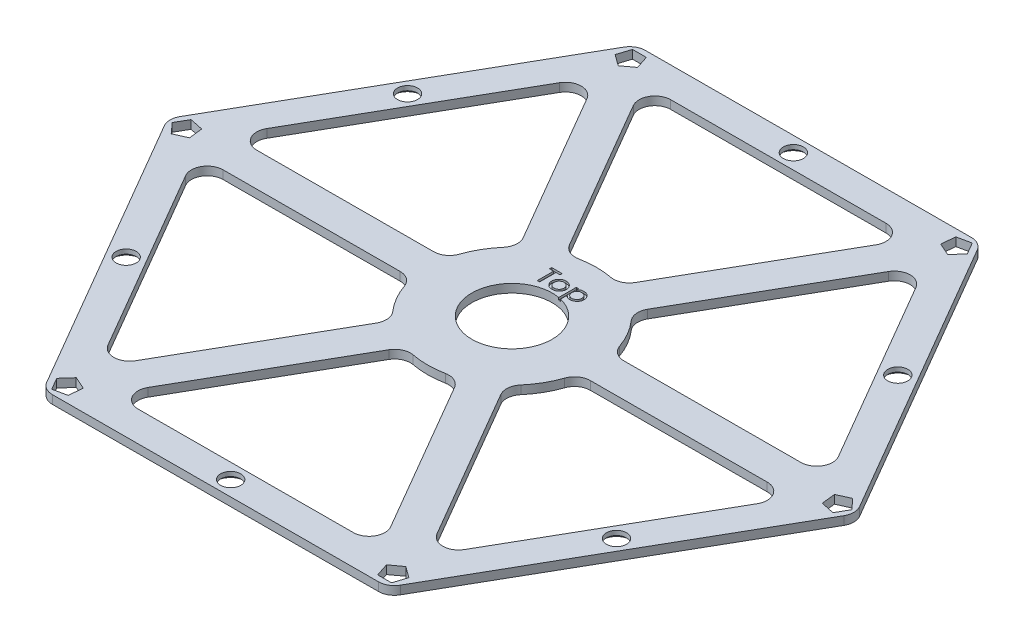
from build123d import *
from OCP.BRepFilletAPI import BRepFilletAPI_MakeChamfer

# Parameters (mm, degrees)
SKETCH1_R           = 1.9
BOSS_EXTRUDE1_DEPTH = 1.6
FILLET1_R           = 3
FILLET2_R           = 3
SKETCH3_R           = 7.6
CUT_EXTRUDE1_DEPTH  = 10
CHAMFER1_SIZE       = 0.75
CHAMFER1_SIZE2      = 0.832959386
CUT_EXTRUDE2_DEPTH  = 0.4
SCALE1_SCALE        = 1.15


with BuildPart() as part:
    # Sketch1 → Boss-Extrude1 (new body)
    with BuildSketch(Plane(origin=(0, 0, 0), x_dir=(1, 0, 0), z_dir=(0, 1, 0))):
        Polygon((-32.670459977, 56.192891409), (-64.999701461, -0.197002589), (-32.329241484, -56.389893998), (32.670459977, -56.192891409), (64.999701461, 0.197002589), (32.329241484, 56.389893998), align=None)
        with Locations(Location((-46.355761236, 26.576510309, 0), (0, 0, 270))):
            Circle(SKETCH1_R, mode=Mode.SUBTRACT)
        with Locations(Location((-0.161947547, 53.433521997, 0), (0, 0, 270))):
            Circle(SKETCH1_R, mode=Mode.SUBTRACT)
        with Locations(Location((46.19381369, 26.857011688, 0), (0, 0, 270))):
            Circle(SKETCH1_R, mode=Mode.SUBTRACT)
        with Locations(Location((46.355761236, -26.576510309, 0), (0, 0, 270))):
            Circle(SKETCH1_R, mode=Mode.SUBTRACT)
        with Locations(Location((0.161947547, -53.433521997, 0), (0, 0, 270))):
            Circle(SKETCH1_R, mode=Mode.SUBTRACT)
        with Locations(Location((-46.19381369, -26.857011688, 0), (0, 0, 270))):
            Circle(SKETCH1_R, mode=Mode.SUBTRACT)
        with BuildLine():
            Line((-31.193440085, 47.277250649), (-56.559443422, 3.032901767))
            Line((-56.559443422, 3.032901767), (-15.685493875, 3.156783473))
            ThreePointArc((-15.685493875, 3.156783473), (-13.880589292, 7.957967134), (-10.649180608, 11.941312842))
            Line((-10.649180608, 11.941312842), (-31.193440085, 47.277250649))
        make_face(mode=Mode.SUBTRACT)
        with BuildLine():
            Line((-56.540020126, -3.375686221), (-30.906291689, -47.465463944))
            Line((-30.906291689, -47.465463944), (-10.576601619, -12.00564443))
            ThreePointArc((-10.576601619, -12.00564443), (-13.832096347, -8.041959379), (-15.666070579, -3.251804515))
            Line((-15.666070579, -3.251804515), (-56.540020126, -3.375686221))
        make_face(mode=Mode.SUBTRACT)
        with BuildLine():
            Line((-25.346580041, -50.65293687), (25.653151733, -50.498365711))
            Line((25.653151733, -50.498365711), (5.108892256, -15.162427903))
            ThreePointArc((5.108892256, -15.162427903), (0.048492945, -15.999926513), (-5.016889971, -15.193117357))
            Line((-5.016889971, -15.193117357), (-25.346580041, -50.65293687))
        make_face(mode=Mode.SUBTRACT)
        with BuildLine():
            Line((31.193440085, -47.277250649), (56.559443422, -3.032901767))
            Line((56.559443422, -3.032901767), (15.685493875, -3.156783473))
            ThreePointArc((15.685493875, -3.156783473), (13.880589292, -7.957967134), (10.649180608, -11.941312842))
            Line((10.649180608, -11.941312842), (31.193440085, -47.277250649))
        make_face(mode=Mode.SUBTRACT)
        with BuildLine():
            Line((56.540020126, 3.375686221), (30.906291689, 47.465463944))
            Line((30.906291689, 47.465463944), (10.576601619, 12.00564443))
            ThreePointArc((10.576601619, 12.00564443), (13.832096347, 8.041959379), (15.666070579, 3.251804515))
            Line((15.666070579, 3.251804515), (56.540020126, 3.375686221))
        make_face(mode=Mode.SUBTRACT)
        with BuildLine():
            Line((25.346580041, 50.65293687), (-25.653151733, 50.498365711))
            Line((-25.653151733, 50.498365711), (-5.108892256, 15.162427903))
            ThreePointArc((-5.108892256, 15.162427903), (-0.048492945, 15.999926513), (5.016889971, 15.193117357))
            Line((5.016889971, 15.193117357), (25.346580041, 50.65293687))
        make_face(mode=Mode.SUBTRACT)
        Polygon((28.764451985, 52.408726504), (31.157091964, 51.352131998), (32.90133947, 53.301162184), (31.586703733, 55.562323589), (29.029966659, 55.010768007), align=None, mode=Mode.SUBTRACT)
        Polygon((-31.00506254, 51.115109397), (-28.893704867, 52.658899148), (-29.709490768, 55.143976891), (-32.325031855, 55.136049649), (-33.125739246, 52.646072601), align=None, mode=Mode.SUBTRACT)
        Polygon((59.769514525, 1.293617108), (60.050796831, -1.30676715), (62.610830237, -1.842814707), (63.911735588, 0.42627394), (62.155705905, 2.364695405), align=None, mode=Mode.SUBTRACT)
        Polygon((31.00506254, -51.115109397), (28.893704867, -52.658899148), (29.709490768, -55.143976891), (32.325031855, -55.136049649), (33.125739246, -52.646072601), align=None, mode=Mode.SUBTRACT)
        Polygon((-28.764451985, -52.408726504), (-31.157091964, -51.352131998), (-32.90133947, -53.301162184), (-31.586703733, -55.562323589), (-29.029966659, -55.010768007), align=None, mode=Mode.SUBTRACT)
        Polygon((-59.769514525, -1.293617108), (-60.050796831, 1.30676715), (-62.610830237, 1.842814707), (-63.911735588, -0.42627394), (-62.155705905, -2.364695405), align=None, mode=Mode.SUBTRACT)
    extrude(amount=BOSS_EXTRUDE1_DEPTH)

    # Fillet1
    fillet1_edges = [part.edges().sort_by_distance(p)[0] for p in [
        (32.329241484, 0.8, -56.389893998),
        (64.999701461, 0.8, -0.197002589),
        (32.670459977, 0.8, 56.192891409),
        (-32.329241484, 0.8, 56.389893998),
        (-64.999701461, 0.8, 0.197002589),
        (-32.670459977, 0.8, -56.192891409),
    ]]
    fillet(fillet1_edges, radius=FILLET1_R)

    # Fillet2
    fillet2_edges = [part.edges().sort_by_distance(p)[0] for p in [
        (-25.653151733, 0.8, -50.498365711),
        (-5.108892256, 0.8, -15.162427903),
        (5.016889971, 0.8, -15.193117357),
        (25.346580041, 0.8, -50.65293687),
        (30.906291689, 0.8, -47.465463944),
        (10.576601619, 0.8, -12.00564443),
        (15.666070579, 0.8, -3.251804515),
        (56.540020126, 0.8, -3.375686221),
        (56.559443422, 0.8, 3.032901767),
        (15.685493875, 0.8, 3.156783473),
        (10.649180608, 0.8, 11.941312842),
        (31.193440085, 0.8, 47.277250649),
        (25.653151733, 0.8, 50.498365711),
        (5.108892256, 0.8, 15.162427903),
        (-5.016889971, 0.8, 15.193117357),
        (-25.346580041, 0.8, 50.65293687),
        (-10.649180608, 0.8, -11.941312842),
        (-31.193440085, 0.8, -47.277250649),
        (-30.906291689, 0.8, 47.465463944),
        (-10.576601619, 0.8, 12.00564443),
        (-15.666070579, 0.8, 3.251804515),
        (-56.540020126, 0.8, 3.375686221),
        (-56.559443422, 0.8, -3.032901767),
        (-15.685493875, 0.8, -3.156783473),
    ]]
    fillet(fillet2_edges, radius=FILLET2_R)

    # Sketch3 → Cut-Extrude1 (cut)
    with BuildSketch(Plane(origin=(0, 3.6, 0), x_dir=(1, 0, 0), z_dir=(0, 1, 0))):
        with Locations(Location((0, 0, 0), (0, 0, 270))):
            Circle(SKETCH3_R)
    extrude(amount=-CUT_EXTRUDE1_DEPTH, mode=Mode.SUBTRACT)

    # Chamfer1: one chamfer whose edges measure the first distance from different faces: ONE call of the kernel's chamfer builder (chamfer() names one face for all edges)
    chamfer1_edges_1 = [part.edges().sort_by_distance(p)[0] for p in [
        (-0.161947547, 0, -55.333521997),
    ]]
    chamfer1_side_1 = [part.faces().sort_by_distance(p)[0] for p in [
        (-0.161947547, 0.8, -55.333521997),
    ]]
    chamfer1_edges_2 = [part.edges().sort_by_distance(p)[0] for p in [
        (46.19381369, 0, -28.757011688),
    ]]
    chamfer1_side_2 = [part.faces().sort_by_distance(p)[0] for p in [
        (46.19381369, 0.8, -28.757011688),
    ]]
    chamfer1_edges_3 = [part.edges().sort_by_distance(p)[0] for p in [
        (46.355761236, 0, 24.676510309),
    ]]
    chamfer1_side_3 = [part.faces().sort_by_distance(p)[0] for p in [
        (46.355761236, 0.8, 24.676510309),
    ]]
    chamfer1_edges_4 = [part.edges().sort_by_distance(p)[0] for p in [
        (0.161947547, 0, 51.533521997),
    ]]
    chamfer1_side_4 = [part.faces().sort_by_distance(p)[0] for p in [
        (0.161947547, 0.8, 51.533521997),
    ]]
    chamfer1_edges_5 = [part.edges().sort_by_distance(p)[0] for p in [
        (-46.19381369, 0, 24.957011688),
    ]]
    chamfer1_side_5 = [part.faces().sort_by_distance(p)[0] for p in [
        (-46.19381369, 0.8, 24.957011688),
    ]]
    chamfer1_edges_6 = [part.edges().sort_by_distance(p)[0] for p in [
        (-46.355761236, 0, -28.476510309),
    ]]
    chamfer1_side_6 = [part.faces().sort_by_distance(p)[0] for p in [
        (-46.355761236, 0.8, -28.476510309),
    ]]
    chamfer1 = BRepFilletAPI_MakeChamfer(part.part.solid().wrapped)
    for e in chamfer1_edges_1:
        chamfer1.Add(CHAMFER1_SIZE, CHAMFER1_SIZE2, e.wrapped, chamfer1_side_1[0].wrapped)  # the first distance lies on this face
    for e in chamfer1_edges_2:
        chamfer1.Add(CHAMFER1_SIZE, CHAMFER1_SIZE2, e.wrapped, chamfer1_side_2[0].wrapped)  # the first distance lies on this face
    for e in chamfer1_edges_3:
        chamfer1.Add(CHAMFER1_SIZE, CHAMFER1_SIZE2, e.wrapped, chamfer1_side_3[0].wrapped)  # the first distance lies on this face
    for e in chamfer1_edges_4:
        chamfer1.Add(CHAMFER1_SIZE, CHAMFER1_SIZE2, e.wrapped, chamfer1_side_4[0].wrapped)  # the first distance lies on this face
    for e in chamfer1_edges_5:
        chamfer1.Add(CHAMFER1_SIZE, CHAMFER1_SIZE2, e.wrapped, chamfer1_side_5[0].wrapped)  # the first distance lies on this face
    for e in chamfer1_edges_6:
        chamfer1.Add(CHAMFER1_SIZE, CHAMFER1_SIZE2, e.wrapped, chamfer1_side_6[0].wrapped)  # the first distance lies on this face
    add(Compound.cast(chamfer1.Shape()), mode=Mode.REPLACE)

    # Sketch4 → Cut-Extrude2 (cut)
    # profile 1 of 3: a face of its own
    with BuildSketch(Plane(origin=(0, 1.6, 0), x_dir=(1, 0, 0), z_dir=(0, 1, 0))):
        Polygon((-4.195512821, 11.318192168), (-4.195512821, 11.722038322), (-2.221153846, 11.722038322), (-2.221153846, 11.318192168), (-2.983974359, 11.318192168), (-2.983974359, 8.222038322), (-3.432692308, 8.222038322), (-3.432692308, 11.318192168), align=None)
    # profile 2 of 3: a face of its own
    with BuildSketch(Plane(origin=(0, 1.6, 0), x_dir=(1, 0, 0), z_dir=(0, 1, 0))):
        with BuildLine():
            add(Edge.make_bspline(
                [(-0.626802885, 10.86947422), (-0.574862942, 10.868051851), (-0.473174337, 10.865267121), (-0.324377097, 10.84567523), (-0.183079004, 10.811634981), (-0.048875089, 10.76504469), (0.077682331, 10.70400491), (0.196909356, 10.630157317), (0.308379715, 10.542065977), (0.37552529, 10.474519901), (0.409455128, 10.440387681)],
                knots=[0, 0, 0, 0, 1.078775739, 2.112039281, 3.110494877, 4.093081892, 5.057110616, 6.022958758, 7.000966324, 8, 8, 8, 8], degree=3))
            add(Edge.make_bspline(
                [(0.409455128, 10.440387681), (0.43954399, 10.406556608), (0.498701039, 10.34004208), (0.575138352, 10.232750989), (0.6402341, 10.122381761), (0.692898308, 10.008102323), (0.734875487, 9.89043525), (0.763986964, 9.7689156), (0.782319173, 9.643773267), (0.784269396, 9.559141548), (0.78525641, 9.516309156)],
                knots=[0, 0, 0, 0, 1.062178036, 2.088324843, 3.086640365, 4.066023852, 5.037709567, 6.014384934, 6.995073642, 8, 8, 8, 8], degree=3))
            add(Edge.make_bspline(
                [(0.78525641, 9.516309156), (0.784022786, 9.473240418), (0.781577913, 9.387884165), (0.762653196, 9.261794784), (0.732723412, 9.139063927), (0.689668596, 9.020251898), (0.634258055, 8.905229783), (0.567782296, 8.79329791), (0.487633865, 8.685946063), (0.397518963, 8.582862985), (0.29737579, 8.487764427), (0.188086388, 8.404506546), (0.070990557, 8.33404822), (-0.053700266, 8.276051294), (-0.18658075, 8.232226861), (-0.32636365, 8.19977213), (-0.47412739, 8.180605516), (-0.575097039, 8.178331193), (-0.626802885, 8.177166527)],
                knots=[0, 0, 0, 0, 0.952871876, 1.888459614, 2.815544184, 3.744891397, 4.679563604, 5.637601804, 6.621431805, 7.640342292, 8.664856555, 9.672479278, 10.67487095, 11.683873433, 12.709444777, 13.765907845, 14.855937143, 16, 16, 16, 16], degree=3))
            add(Edge.make_bspline(
                [(-0.626802885, 8.177166527), (-0.676184265, 8.17830072), (-0.772986067, 8.180524065), (-0.914443106, 8.200262511), (-1.049332809, 8.230385606), (-1.176671465, 8.275199956), (-1.297508081, 8.331241182), (-1.411034318, 8.400749179), (-1.5181246, 8.482070299), (-1.615985369, 8.57615924), (-1.705182623, 8.677308227), (-1.782604413, 8.784691298), (-1.849194447, 8.895811899), (-1.903331187, 9.011609949), (-1.944816948, 9.132043812), (-1.975192516, 9.256119619), (-1.992930597, 9.38492264), (-1.995494166, 9.47208475), (-1.996794872, 9.516309156)],
                knots=[0, 0, 0, 0, 1.108842573, 2.173652473, 3.202745058, 4.208988794, 5.200203338, 6.189803525, 7.193715926, 8.215010613, 9.234454675, 10.219573757, 11.184848795, 12.140854958, 13.08565054, 14.042002664, 15.006549187, 16, 16, 16, 16], degree=3))
            add(Edge.make_bspline(
                [(-1.996794872, 9.516309156), (-1.995735509, 9.560063738), (-1.993648355, 9.646268922), (-1.976539254, 9.773376284), (-1.947510408, 9.895507846), (-1.908377459, 10.013652004), (-1.856702632, 10.12690919), (-1.793879348, 10.23591848), (-1.720475726, 10.341082359), (-1.663256551, 10.405633923), (-1.634314904, 10.438284316)],
                knots=[0, 0, 0, 0, 1.034079547, 2.037341334, 3.024980457, 3.998111168, 4.974764182, 5.962233312, 6.969290918, 8, 8, 8, 8], degree=3))
            add(Edge.make_bspline(
                [(-1.634314904, 10.438284316), (-1.600645876, 10.472678039), (-1.534269324, 10.540483286), (-1.423786355, 10.628392675), (-1.307221087, 10.703347171), (-1.183400795, 10.76361863), (-1.053770542, 10.812045135), (-0.917056664, 10.845420478), (-0.773921639, 10.865261451), (-0.676412327, 10.868053646), (-0.626802885, 10.86947422)],
                knots=[0, 0, 0, 0, 1.021997278, 2.014808882, 2.992991082, 3.961403697, 4.935644248, 5.92819495, 6.945935601, 8, 8, 8, 8], degree=3))
        make_face()
        with BuildLine():
            add(Edge.make_bspline(
                [(-0.628205128, 10.465628066), (-0.658164466, 10.46482974), (-0.71765033, 10.463244621), (-0.805268138, 10.450273712), (-0.890428764, 10.42929856), (-0.972197711, 10.398846204), (-1.051809207, 10.36078995), (-1.127925293, 10.31338932), (-1.202261414, 10.258568034), (-1.27211138, 10.19508646), (-1.337099802, 10.125977491), (-1.393407015, 10.051031115), (-1.441576261, 9.972348665), (-1.480152783, 9.888936969), (-1.510632752, 9.801362259), (-1.531960041, 9.709456266), (-1.546016964, 9.613262242), (-1.547380859, 9.547677128), (-1.548076923, 9.51420579)],
                knots=[0, 0, 0, 0, 0.976916649, 1.939720157, 2.882730922, 3.833047911, 4.780976627, 5.756404754, 6.753607, 7.790049989, 8.831165002, 9.84360893, 10.842529111, 11.835057585, 12.835634664, 13.861933882, 14.908838789, 16, 16, 16, 16], degree=3))
            add(Edge.make_bspline(
                [(-1.548076923, 9.51420579), (-1.546483198, 9.470612649), (-1.543346706, 9.38482019), (-1.517717028, 9.259156032), (-1.477041358, 9.139058723), (-1.420249692, 9.026095344), (-1.350823634, 8.922747007), (-1.269896722, 8.832271182), (-1.180563261, 8.75394767), (-1.081098551, 8.691050916), (-0.974912851, 8.641822252), (-0.863443309, 8.606776005), (-0.747318487, 8.584872773), (-0.668265914, 8.582310926), (-0.628205128, 8.581012681)],
                knots=[0, 0, 0, 0, 1.073737222, 2.11314337, 3.147909503, 4.191315005, 5.220292011, 6.207728104, 7.175628903, 8.139268678, 9.098074859, 10.052770626, 11.013219503, 12, 12, 12, 12], degree=3))
            add(Edge.make_bspline(
                [(-0.628205128, 8.581012681), (-0.584868823, 8.582493377), (-0.499472342, 8.585411166), (-0.374397463, 8.60860139), (-0.254951229, 8.645835962), (-0.141970614, 8.697730086), (-0.037118693, 8.763472846), (0.056640938, 8.843261894), (0.138813187, 8.93577446), (0.209173352, 9.038894024), (0.265992198, 9.150779283), (0.306785061, 9.268202559), (0.331528135, 9.390013292), (0.334855597, 9.472492119), (0.336538462, 9.51420579)],
                knots=[0, 0, 0, 0, 1.042880454, 2.055051067, 3.051726387, 4.048830532, 5.040201766, 6.022282375, 7.002717173, 8.011000956, 9.020163719, 10.014978664, 10.996075346, 12, 12, 12, 12], degree=3))
            add(Edge.make_bspline(
                [(0.336538462, 9.51420579), (0.335807238, 9.546504974), (0.3343648, 9.610219439), (0.320597481, 9.703961031), (0.298253385, 9.794226439), (0.266501981, 9.880612513), (0.226293665, 9.963419763), (0.176822285, 10.042295176), (0.118263113, 10.117614726), (0.051506932, 10.188159385), (-0.020857305, 10.253022051), (-0.097319522, 10.310303311), (-0.177722803, 10.35787742), (-0.260952746, 10.397968584), (-0.348183391, 10.427759865), (-0.438518269, 10.449585381), (-0.532188097, 10.463483002), (-0.595904807, 10.464906462), (-0.628205128, 10.465628066)],
                knots=[0, 0, 0, 0, 1.02928639, 2.030405262, 3.013559112, 3.98951401, 4.959304921, 5.943474834, 6.952548865, 7.996299005, 9.035918103, 10.047849461, 11.03697177, 12.01024899, 12.98822153, 13.969594738, 14.97071361, 16, 16, 16, 16], degree=3))
        make_face(mode=Mode.SUBTRACT)
    # profile 3 of 3: a face of its own
    with BuildSketch(Plane(origin=(0, 1.6, 0), x_dir=(1, 0, 0), z_dir=(0, 1, 0))):
        with BuildLine():
            Line((1.368589744, 10.824602425), (1.817307692, 10.824602425))
            Line((1.817307692, 10.824602425), (1.817307692, 10.360459797))
            add(Edge.make_bspline(
                [(1.817307692, 10.360459797), (1.824038452, 10.381229599), (1.837351026, 10.422309594), (1.86621055, 10.480024788), (1.899677801, 10.534284222), (1.939288929, 10.584291413), (1.98443661, 10.630408724), (2.036197656, 10.671547236), (2.093112112, 10.709906289), (2.177849251, 10.754028138), (2.290908547, 10.801100971), (2.434809193, 10.840800384), (2.585822894, 10.865412419), (2.688940459, 10.868104847), (2.741386218, 10.86947422)],
                knots=[0, 0, 0, 0, 0.694622356, 1.37387354, 2.049401652, 2.722628407, 3.401757179, 4.100556256, 4.825325589, 5.584715007, 7.140148756, 8.717099778, 10.330311678, 12, 12, 12, 12], degree=3))
            add(Edge.make_bspline(
                [(2.741386218, 10.86947422), (2.789829665, 10.868307137), (2.885458385, 10.866003282), (3.025545541, 10.846436272), (3.160299756, 10.81590684), (3.288652477, 10.771418621), (3.411695499, 10.714848563), (3.529070953, 10.64634236), (3.639773203, 10.563764963), (3.743895035, 10.470995664), (3.838302909, 10.369086222), (3.922494932, 10.262732632), (3.992845075, 10.15117593), (4.051241115, 10.035699763), (4.094923457, 9.915168132), (4.127895512, 9.790964657), (4.147040363, 9.662038937), (4.149431787, 9.574563894), (4.150641026, 9.530331592)],
                knots=[0, 0, 0, 0, 1.076228782, 2.124505721, 3.137534021, 4.142835799, 5.137588531, 6.143359867, 7.157306602, 8.202064418, 9.238473371, 10.241181928, 11.212440163, 12.164848115, 13.111430887, 14.056330489, 15.017171362, 16, 16, 16, 16], degree=3))
            add(Edge.make_bspline(
                [(4.150641026, 9.530331592), (4.149457266, 9.48515856), (4.147115912, 9.395810973), (4.127605052, 9.264260952), (4.096174121, 9.137350626), (4.051552675, 9.015231846), (3.994593616, 8.897705192), (3.924694312, 8.785029935), (3.842146361, 8.677362493), (3.748050564, 8.575973876), (3.645404716, 8.482618576), (3.535460725, 8.400577401), (3.419317166, 8.331587116), (3.297054838, 8.275272089), (3.169225608, 8.230603558), (3.034875743, 8.200302054), (2.895049416, 8.180586127), (2.799647734, 8.178318201), (2.751201923, 8.177166527)],
                knots=[0, 0, 0, 0, 1.000690261, 1.979261891, 2.940227073, 3.893808351, 4.855122405, 5.829614775, 6.827190625, 7.857089307, 8.891134036, 9.89799758, 10.891950105, 11.879132496, 12.876641118, 13.886749785, 14.926872999, 16, 16, 16, 16], degree=3))
            add(Edge.make_bspline(
                [(2.751201923, 8.177166527), (2.699468689, 8.178866034), (2.597548767, 8.182214241), (2.447730778, 8.206279686), (2.304979423, 8.247503813), (2.191426482, 8.2934366), (2.107434713, 8.339253024), (2.049168121, 8.376484857), (1.996580826, 8.417825522), (1.949552226, 8.462816915), (1.907717469, 8.510728405), (1.871569453, 8.562328171), (1.841485305, 8.617825329), (1.825382563, 8.656814009), (1.817307692, 8.676365245)],
                knots=[0, 0, 0, 0, 1.656042569, 3.26257835, 4.842282913, 6.405528061, 7.172280682, 7.902838742, 8.616847869, 9.310130132, 9.983752423, 10.650062733, 11.323061395, 12, 12, 12, 12], degree=3))
            Line((1.817307692, 8.676365245), (1.817307692, 7.27973063))
            Line((1.817307692, 7.27973063), (1.368589744, 7.27973063))
            Line((1.368589744, 7.27973063), (1.368589744, 10.824602425))
        make_face()
        with BuildLine():
            add(Edge.make_bspline(
                [(2.735777244, 10.465628066), (2.704878311, 10.464869783), (2.643984721, 10.463375409), (2.554397927, 10.450011641), (2.468037983, 10.430220551), (2.384862594, 10.400940167), (2.305284932, 10.363199884), (2.229056278, 10.316951077), (2.155540003, 10.26365154), (2.086896657, 10.201655571), (2.024233933, 10.133174746), (1.967888211, 10.060208073), (1.921848869, 9.981176876), (1.883788687, 9.897737638), (1.853197855, 9.809859048), (1.83258088, 9.716669835), (1.819573036, 9.618808663), (1.81807322, 9.551875176), (1.817307692, 9.517711399)],
                knots=[0, 0, 0, 0, 1.005723403, 1.982013728, 2.943867151, 3.887478966, 4.847584166, 5.806995223, 6.787400874, 7.800641986, 8.813368399, 9.807417327, 10.796880851, 11.78458637, 12.790712903, 13.821019732, 14.887818371, 16, 16, 16, 16], degree=3))
            add(Edge.make_bspline(
                [(1.817307692, 9.517711399), (1.818719241, 9.472738881), (1.821473969, 9.384972106), (1.845063658, 9.25726855), (1.884558849, 9.138046494), (1.938679474, 9.027318985), (2.006755764, 8.926808509), (2.087661325, 8.837891797), (2.179352844, 8.759448312), (2.283140026, 8.696084575), (2.39306728, 8.644974871), (2.50686325, 8.608585267), (2.622826264, 8.584603598), (2.701304866, 8.582212516), (2.740685096, 8.581012681)],
                knots=[0, 0, 0, 0, 1.102029977, 2.150682694, 3.17089293, 4.172933106, 5.163105818, 6.136792055, 7.112634256, 8.111227658, 9.108587182, 10.078099529, 11.035598473, 12, 12, 12, 12], degree=3))
            add(Edge.make_bspline(
                [(2.740685096, 8.581012681), (2.782387135, 8.582481993), (2.865042362, 8.585394231), (2.986862974, 8.609165032), (3.104045558, 8.649244989), (3.216867521, 8.702696696), (3.32187817, 8.771283206), (3.416649885, 8.853576619), (3.500862717, 8.947965992), (3.571408516, 9.054463786), (3.629730388, 9.167561012), (3.671172744, 9.285277422), (3.696977351, 9.405348429), (3.700271869, 9.486268801), (3.701923077, 9.526825983)],
                knots=[0, 0, 0, 0, 1.003862332, 1.989698134, 2.97583922, 3.980411469, 4.988981437, 5.986622354, 6.995396503, 8.025784312, 9.055403073, 10.052376809, 11.023853872, 12, 12, 12, 12], degree=3))
            add(Edge.make_bspline(
                [(3.701923077, 9.526825983), (3.70028951, 9.567619264), (3.697039487, 9.64877849), (3.671239031, 9.768554232), (3.630446349, 9.885374105), (3.5728816, 9.997163428), (3.502639613, 10.101935562), (3.420406091, 10.196376308), (3.325041668, 10.27669204), (3.220057916, 10.344729646), (3.106792316, 10.398444697), (2.987661612, 10.437461559), (2.863399917, 10.461321755), (2.778650468, 10.464181415), (2.735777244, 10.465628066)],
                knots=[0, 0, 0, 0, 0.980928904, 1.951581945, 2.935231878, 3.951401631, 4.96844259, 5.964697687, 6.954166899, 7.958816287, 8.967613111, 9.961818216, 10.968920427, 12, 12, 12, 12], degree=3))
        make_face(mode=Mode.SUBTRACT)
    extrude(amount=-CUT_EXTRUDE2_DEPTH, mode=Mode.SUBTRACT)


with BuildPart() as part_1:
    # Scale1: scaled about (-5.8283e-05, 0.801771263, 0.005259563)
    add(part.part.scale(SCALE1_SCALE).moved(Location((8.742e-06, -0.120265689, -0.000788934))))


solid = part_1.part
